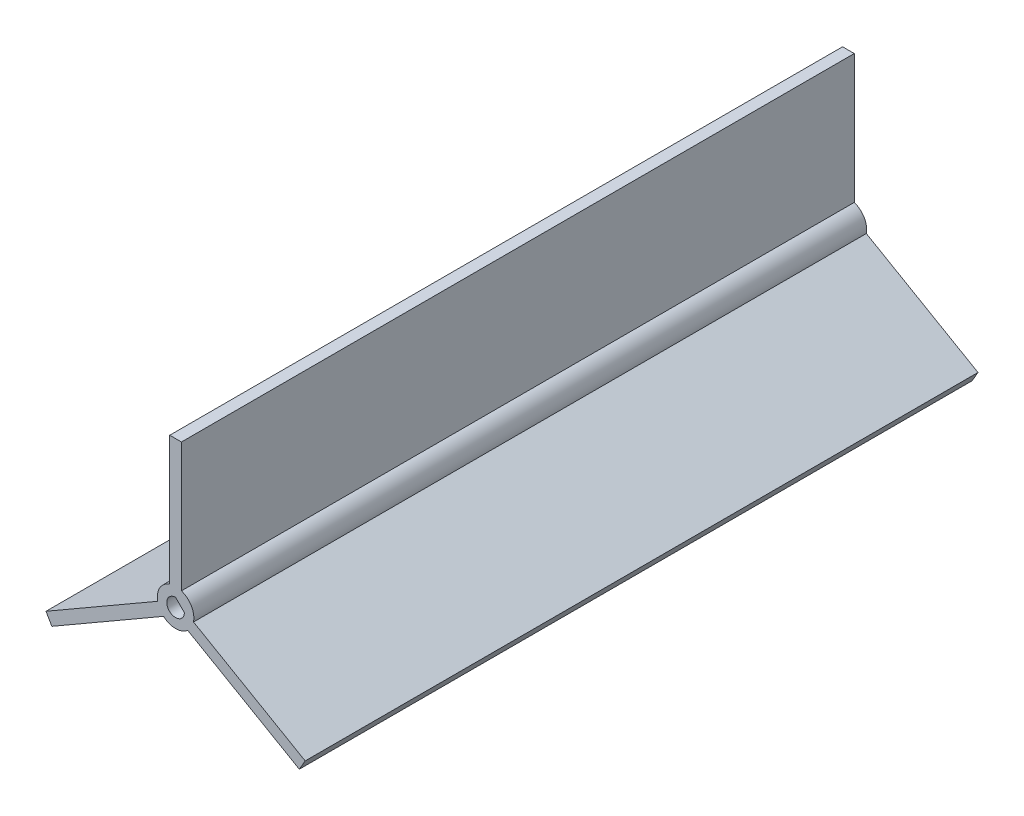
from build123d import *

# Parameters (mm, degrees)
BOSS_EXTRUDE1_DEPTH     = 292.1
CUT_EXTRUDE1_DEPTH      = 305.17123736
CUT_EXTRUDE1_DEPTH_BACK = 305.17123736


with BuildPart() as part:
    # Sketch1 → Boss-Extrude1 (new body)
    with BuildSketch(Plane.XY):
        with BuildLine():
            Line((-2.54, 1.466469684), (-2.54, 7.520126744))
            ThreePointArc((-2.54, 7.520126744), (-6.874076643, 3.96875), (-7.7826208, -1.560358847))
            Line((-7.7826208, -1.560358847), (-2.54, 1.466469684))
        make_face()
        with BuildLine():
            ThreePointArc((-5.2426208, -5.959767898), (0, -7.9375), (5.2426208, -5.959767898))
            Line((5.2426208, -5.959767898), (0, -2.932939367))
            Line((0, -2.932939367), (-5.2426208, -5.959767898))
        make_face()
        with BuildLine():
            ThreePointArc((7.9375, 0), (6.448455484, 4.628318067), (2.54, 7.520126744))
            Line((2.54, 7.520126744), (2.54, 1.466469684))
            Line((2.54, 1.466469684), (7.7826208, -1.560358847))
            ThreePointArc((7.7826208, -1.560358847), (7.898685297, -0.784013281), (7.9375, 0))
        make_face()
        with BuildLine():
            Line((6.874076643, -3.96875), (0, 0))
            Line((0, 0), (-6.874076643, -3.96875))
            ThreePointArc((-6.874076643, -3.96875), (-6.139595043, -5.030832829), (-5.2426208, -5.959767898))
            Line((-5.2426208, -5.959767898), (0, -2.932939367))
            Line((0, -2.932939367), (5.2426208, -5.959767898))
            ThreePointArc((5.2426208, -5.959767898), (6.139595043, -5.030832829), (6.874076643, -3.96875))
        make_face()
        with BuildLine():
            Line((-6.874076643, -3.96875), (0, 0))
            Line((0, 0), (0, 7.9375))
            ThreePointArc((0, 7.9375), (-1.28703151, 7.832461691), (-2.54, 7.520126744))
            Line((-2.54, 7.520126744), (-2.54, 1.466469684))
            Line((-2.54, 1.466469684), (-7.7826208, -1.560358847))
            ThreePointArc((-7.7826208, -1.560358847), (-7.426626554, -2.801628862), (-6.874076643, -3.96875))
        make_face()
        with BuildLine():
            Line((0, 7.9375), (0, 0))
            Line((0, 0), (6.874076643, -3.96875))
            ThreePointArc((6.874076643, -3.96875), (7.426626554, -2.801628862), (7.7826208, -1.560358847))
            Line((7.7826208, -1.560358847), (2.54, 1.466469684))
            Line((2.54, 1.466469684), (2.54, 7.520126744))
            ThreePointArc((2.54, 7.520126744), (1.28703151, 7.832461691), (0, 7.9375))
        make_face()
        with BuildLine():
            Line((0, 63.5), (0, 7.9375))
            ThreePointArc((0, 7.9375), (1.28703151, 7.832461691), (2.54, 7.520126744))
            Line((2.54, 7.520126744), (2.54, 63.5))
            Line((2.54, 63.5), (0, 63.5))
        make_face()
        with BuildLine():
            ThreePointArc((-2.54, 7.520126744), (-1.28703151, 7.832461691), (0, 7.9375))
            Line((0, 7.9375), (0, 63.5))
            Line((0, 63.5), (-2.54, 63.5))
            Line((-2.54, 63.5), (-2.54, 7.520126744))
        make_face()
        with BuildLine():
            Line((-54.99261314, -31.75), (-6.874076643, -3.96875))
            ThreePointArc((-6.874076643, -3.96875), (-7.426626554, -2.801628862), (-7.7826208, -1.560358847))
            Line((-7.7826208, -1.560358847), (-56.26261314, -29.550295474))
            Line((-56.26261314, -29.550295474), (-54.99261314, -31.75))
        make_face()
        with BuildLine():
            ThreePointArc((-5.2426208, -5.959767898), (-6.139595043, -5.030832829), (-6.874076643, -3.96875))
            Line((-6.874076643, -3.96875), (-54.99261314, -31.75))
            Line((-54.99261314, -31.75), (-53.72261314, -33.949704526))
            Line((-53.72261314, -33.949704526), (-5.2426208, -5.959767898))
        make_face()
        with BuildLine():
            Line((54.99261314, -31.75), (6.874076643, -3.96875))
            ThreePointArc((6.874076643, -3.96875), (6.139595043, -5.030832829), (5.2426208, -5.959767898))
            Line((5.2426208, -5.959767898), (53.72261314, -33.949704526))
            Line((53.72261314, -33.949704526), (54.99261314, -31.75))
        make_face()
        with BuildLine():
            ThreePointArc((7.7826208, -1.560358847), (7.426626554, -2.801628862), (6.874076643, -3.96875))
            Line((6.874076643, -3.96875), (54.99261314, -31.75))
            Line((54.99261314, -31.75), (56.26261314, -29.550295474))
            Line((56.26261314, -29.550295474), (7.7826208, -1.560358847))
        make_face()
    extrude(amount=BOSS_EXTRUDE1_DEPTH)

    # Sketch2 → Cut-Extrude1 (cut, two sides: drawn at the far end of the back side and taken through both)
    with BuildSketch(Plane.XY.offset(292.1).offset(-CUT_EXTRUDE1_DEPTH_BACK)):
        with BuildLine():
            Line((0, 3.81), (3.81, 0))
            ThreePointArc((3.81, 0), (-2.694076836, -2.694076836), (0, 3.81))
        make_face()
    extrude(amount=CUT_EXTRUDE1_DEPTH + CUT_EXTRUDE1_DEPTH_BACK, mode=Mode.SUBTRACT)


solid = part.part
